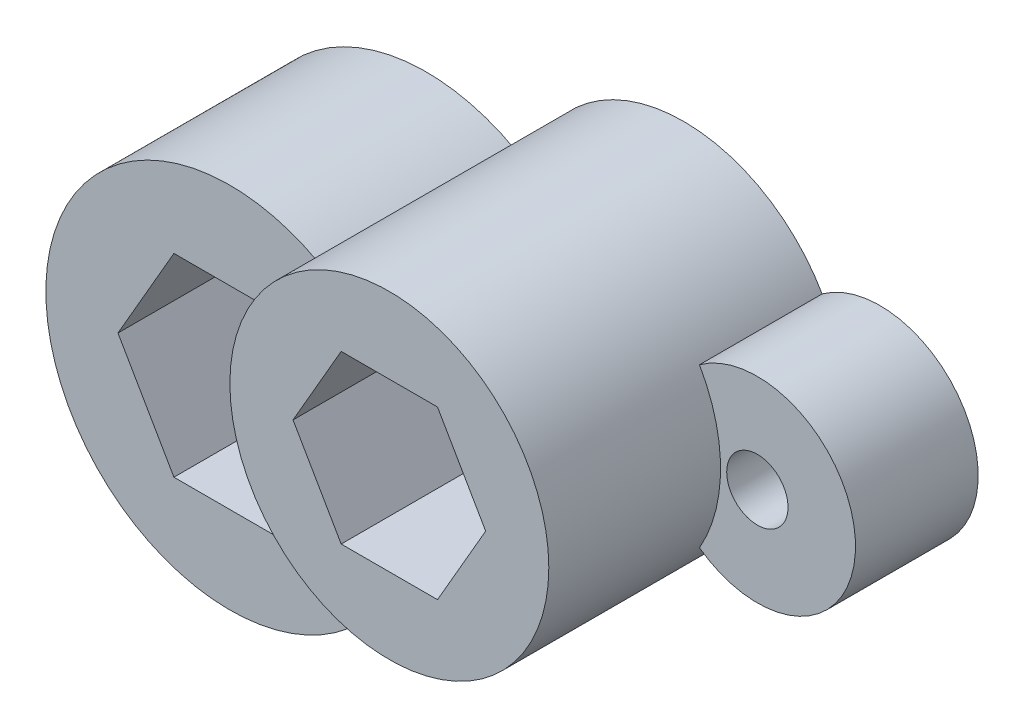
from build123d import *

# Parameters (mm, degrees)
SKETCH_1_R      = 7.5
EXTRUDE_1_DEPTH = 8
SKETCH_2_R      = 6.5
EXTRUDE_2_DEPTH = 12
SKETCH_3_R      = 4
SKETCH_3_R_2    = 1.25
EXTRUDE_3_DEPTH = 5


with BuildPart() as part:
    # Эскиз1 → Бобышка-Вытянуть1 (new body)
    with BuildSketch(Plane.XY):
        Circle(SKETCH_1_R)
        Polygon((2.280533563, -3.95), (4.561067127, 0), (2.280533563, 3.95), (-2.280533563, 3.95), (-4.561067127, 0), (-2.280533563, -3.95), align=None, mode=Mode.SUBTRACT)
    extrude(amount=EXTRUDE_1_DEPTH)

    # Эскиз2 → Бобышка-Вытянуть2 (add)
    with BuildSketch(Plane(origin=(0, 0, 0), x_dir=(-1, 0, 0), z_dir=(0, 0, -1))):
        with Locations((-10.5, 4.5)):
            Circle(SKETCH_2_R)
        Polygon((-8.537009085, 1.1), (-6.57401817, 4.5), (-8.537009085, 7.9), (-12.462990915, 7.9), (-14.42598183, 4.5), (-12.462990915, 1.1), align=None, mode=Mode.SUBTRACT)
    extrude(amount=-EXTRUDE_2_DEPTH)

    # Эскиз3 → Бобышка-Вытянуть3 (add)
    with BuildSketch(Plane(origin=(0, 0, 0), x_dir=(-1, 0, 0), z_dir=(0, 0, -1))):
        with Locations((-18.5, 4.5)):
            Circle(SKETCH_3_R)
        with Locations((-18.5, 4.5)):
            Circle(SKETCH_3_R_2, mode=Mode.SUBTRACT)
    extrude(amount=-EXTRUDE_3_DEPTH)


solid = part.part
